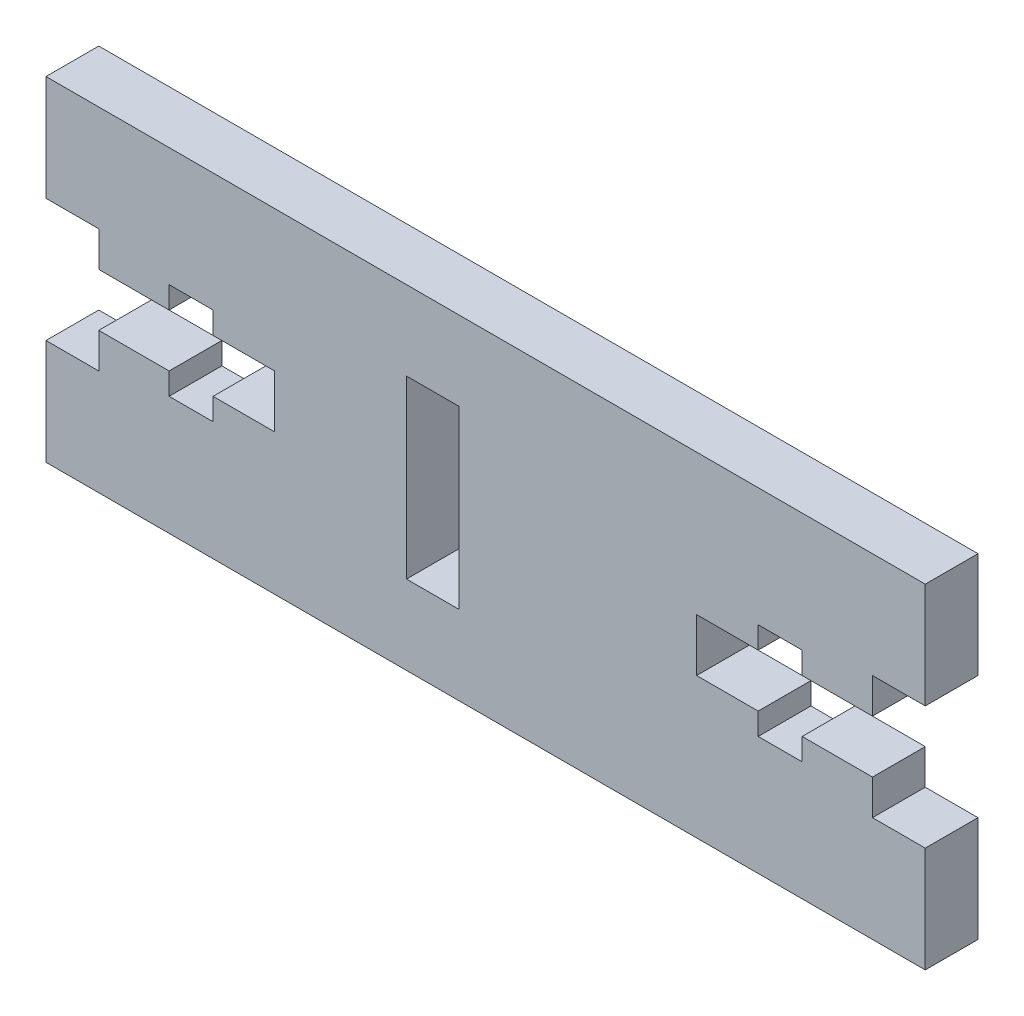
from build123d import *

# Parameters (mm, degrees)
SKETCH_1_W      = 2.9999
SKETCH_1_H      = 9.999
EXTRUDE_1_DEPTH = 3


with BuildPart() as part:
    # 草图1 → 凸台-拉伸1 (new body)
    with BuildSketch(Plane.XY.offset(3)):
        Polygon((45.580049157, 0), (45.580049157, 5.99999), (42.580009157, 5.99999), (42.580009157, 7.99949), (38.581009157, 7.99949), (38.581009157, 6.74959), (36.079809157, 6.74959), (36.079809157, 7.99949), (32.580009157, 7.99949), (32.580009157, 10.99949), (36.079809157, 10.99949), (36.079809157, 12.25079), (38.581009157, 12.25079), (38.581009157, 10.99949), (42.580009157, 10.99949), (42.580009157, 13.00039), (45.580049157, 13.00039), (45.580049157, 19.00039), (-4.419390843, 19.00039), (-4.419390843, 13.00039), (-1.419350843, 13.00039), (-1.419350843, 10.99949), (2.579649157, 10.99949), (2.579649157, 12.25079), (5.080849157, 12.25079), (5.080849157, 10.99949), (8.580649157, 10.99949), (8.580649157, 7.99949), (5.080849157, 7.99949), (5.080849157, 6.74959), (2.579649157, 6.74959), (2.579649157, 7.99949), (-1.419350843, 7.99949), (-1.419350843, 5.99999), (-4.419390843, 5.99999), (-4.419390843, 0), align=None)
        with Locations((17.580299157, 9.50019)):
            Rectangle(SKETCH_1_W, SKETCH_1_H, mode=Mode.SUBTRACT)
    extrude(amount=-EXTRUDE_1_DEPTH)


solid = part.part
